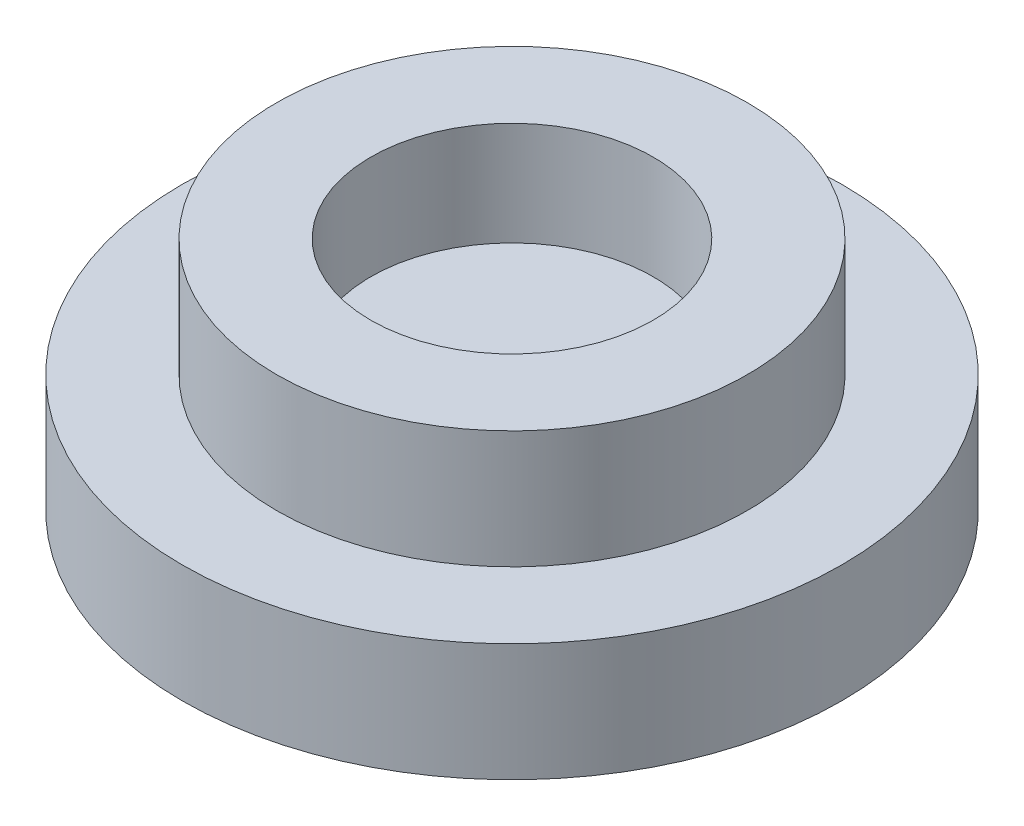
from build123d import *

# Parameters (mm, degrees)
MAGNET_OUTER_DIM_R  = 5
BOSS_EXTRUDE7_DEPTH = 2.5
CUT_EXTRUDE1_START  = 0.3
MAGNET_DIM_R        = 3
CUT_EXTRUDE1_DEPTH  = 2.2
MOTOTR_OUTER_DIM_R  = 7
BOSS_EXTRUDE8_DEPTH = 2.5
CUT_EXTRUDE4_START  = -3.4
MOTOR_DIM_R         = 5
CUT_EXTRUDE4_DEPTH  = 3.2


with BuildPart() as part:
    # magnet_outer_dim → Boss-Extrude7 (new body)
    with BuildSketch(Plane(origin=(0, 0, 0), x_dir=(1, 0, 0), z_dir=(0, 1, 0))):
        with Locations(Location((0, 0, 0), (0, 0, 270))):
            Circle(MAGNET_OUTER_DIM_R)
    extrude(amount=BOSS_EXTRUDE7_DEPTH)

    # magnet_dim → Cut-Extrude1 (cut)
    with BuildSketch(Plane(origin=(0, 0, 0), x_dir=(1, 0, 0), z_dir=(0, 1, 0)).offset(CUT_EXTRUDE1_START)):
        with Locations(Location((0, 0, 0), (0, 0, 270))):
            Circle(MAGNET_DIM_R)
    extrude(amount=CUT_EXTRUDE1_DEPTH, mode=Mode.SUBTRACT)

    # mototr_outer_dim → Boss-Extrude8 (add)
    with BuildSketch(Plane(origin=(0, 0, 0), x_dir=(1, 0, 0), z_dir=(0, 1, 0))):
        with Locations(Location((0, 0, 0), (0, 0, 270))):
            Circle(MOTOTR_OUTER_DIM_R)
    extrude(amount=-BOSS_EXTRUDE8_DEPTH)

    # motor_dim → Cut-Extrude4 (cut)
    with BuildSketch(Plane(origin=(0, 0, 0), x_dir=(1, 0, 0), z_dir=(0, 1, 0)).offset(CUT_EXTRUDE4_START)):
        with Locations(Location((0, 0, 0), (0, 0, 270))):
            Circle(MOTOR_DIM_R)
    extrude(amount=CUT_EXTRUDE4_DEPTH, mode=Mode.SUBTRACT)


solid = part.part
